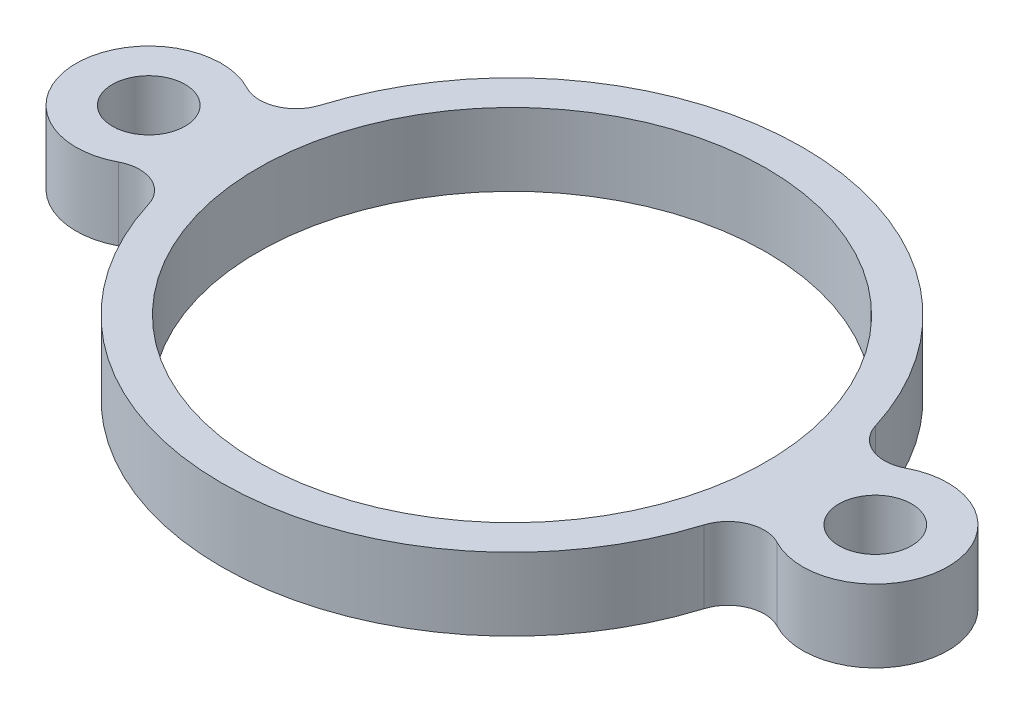
from build123d import *

# Parameters (mm, degrees)
SKETCH1_R           = 35
SKETCH1_R_2         = 5
BOSS_EXTRUDE1_DEPTH = 10


with BuildPart() as part:
    # Sketch1 → Boss-Extrude1 (new body)
    with BuildSketch(Plane(origin=(0, 0, 0), x_dir=(1, 0, 0), z_dir=(0, 1, 0))):
        with BuildLine():
            ThreePointArc((-38.222222222, -11.792443699), (0, -40), (38.222222222, -11.792443699))
            ThreePointArc((38.222222222, -11.792443699), (41.085145784, -8.647697008), (45.333333333, -8.844332774))
            ThreePointArc((45.333333333, -8.844332774), (60, 0), (45.333333333, 8.844332774))
            ThreePointArc((45.333333333, 8.844332774), (41.085145784, 8.647697008), (38.222222222, 11.792443699))
            ThreePointArc((38.222222222, 11.792443699), (0, 40), (-38.222222222, 11.792443699))
            ThreePointArc((-38.222222222, 11.792443699), (-41.085145784, 8.647697008), (-45.333333333, 8.844332774))
            ThreePointArc((-45.333333333, 8.844332774), (-60, 0), (-45.333333333, -8.844332774))
            ThreePointArc((-45.333333333, -8.844332774), (-41.085145784, -8.647697008), (-38.222222222, -11.792443699))
        make_face()
        with Locations(Location((0, 0, 0), (0, 0, 270))):
            Circle(SKETCH1_R, mode=Mode.SUBTRACT)
        with Locations(Location((-50, 0, 0), (0, 0, 270))):
            Circle(SKETCH1_R_2, mode=Mode.SUBTRACT)
        with Locations(Location((50, 0, 0), (0, 0, 270))):
            Circle(SKETCH1_R_2, mode=Mode.SUBTRACT)
    extrude(amount=BOSS_EXTRUDE1_DEPTH)


solid = part.part
